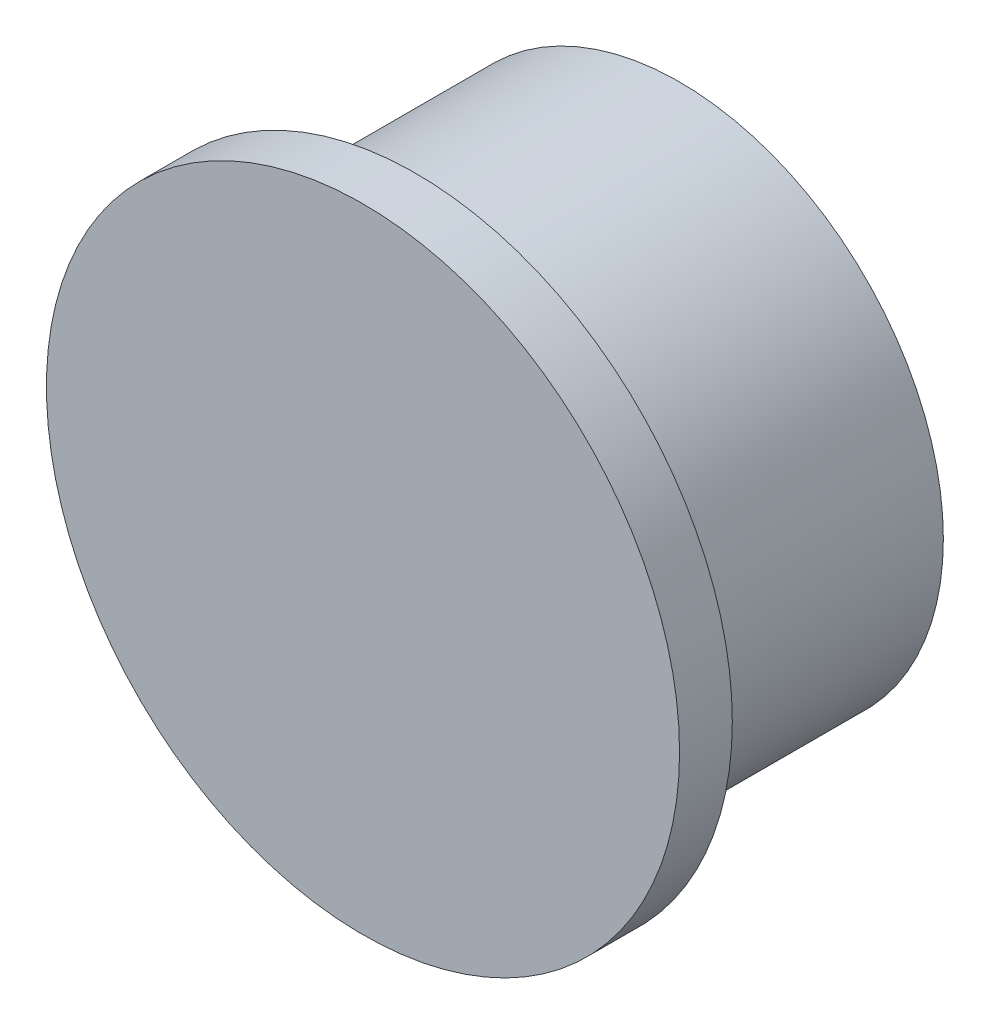
from build123d import *

# Parameters (mm, degrees)
SKETCH_1_R          = 25
SKETCH_1_R_2        = 20
EXTRUDE_3_DEPTH     = 25
SKETCH_12_R         = 1.5
CUT_EXTRUDE_3_DEPTH = 15
SKETCH_13_R         = 30
EXTRUDE_5_DEPTH     = 5


with BuildPart() as part:
    # 草图1 → 凸台-拉伸3 (new body)
    with BuildSketch(Plane.XY):
        with Locations((-41.161572615, 8.306984042)):
            Circle(SKETCH_1_R)
        with Locations((-41.161572615, 8.306984042)):
            Circle(SKETCH_1_R_2, mode=Mode.SUBTRACT)
    extrude(amount=EXTRUDE_3_DEPTH)

    # 草图12 → 切除-拉伸3 (cut)
    with BuildSketch(Plane(origin=(0, 0, 0), x_dir=(-1, 0, 0), z_dir=(0, 0, -1))):
        with Locations((41.161572615, 30.806984042)):
            Circle(SKETCH_12_R)
        with Locations((63.661572615, 8.306984042)):
            Circle(SKETCH_12_R)
        with Locations((41.161572615, -14.193015958)):
            Circle(SKETCH_12_R)
        with Locations((18.661572615, 8.306984042)):
            Circle(SKETCH_12_R)
    extrude(amount=-CUT_EXTRUDE_3_DEPTH, mode=Mode.SUBTRACT)

    # 草图13 → 凸台-拉伸5 (add)
    with BuildSketch(Plane.XY.offset(25)):
        with Locations((-41.161572615, 8.306984042)):
            Circle(SKETCH_13_R)
    extrude(amount=EXTRUDE_5_DEPTH)


solid = part.part
